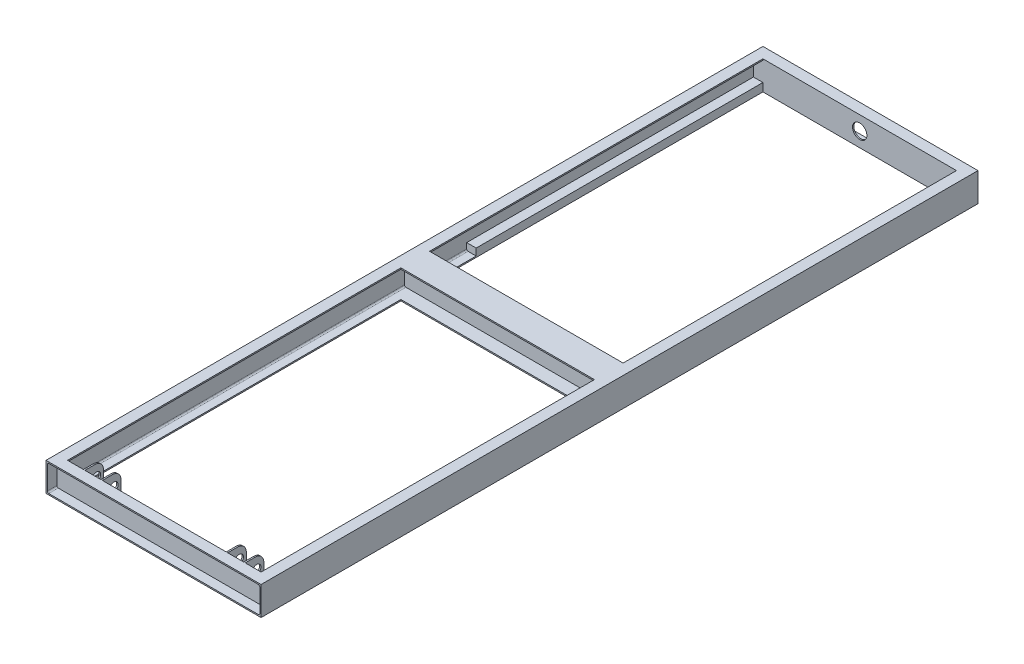
from build123d import *

# Parameters (mm, degrees)
EXTRUDE_1_DEPTH          = 5000
EXTRUDE_3_DEPTH          = 1500
EXTRUDE_START            = -5000
EXTRUDE_4_DEPTH          = 5000
SKETCH_5_W               = 10
SKETCH_5_H               = 130
EXTRUDE_5_DEPTH          = 200
CUT_EXTRUDE_1_DEPTH      = 1006
CUT_EXTRUDE_1_DEPTH_BACK = 147
SKETCH_6_R               = 30
FILLET_1_R               = 60
SKETCH_7_W               = 70
SKETCH_7_H               = 2000
EXTRUDE_6_DEPTH          = 48
EXTRUDE_7_REACH          = 5224.593
SKETCH_9_R               = 50
CUT_EXTRUDE_2_DEPTH      = 219
SCALE_3_SCALE            = 0.345


with BuildPart() as part:
    # 草图1 → 凸台-拉伸1 (new body)
    with BuildSketch(Plane.XY):
        with BuildLine():
            Line((0, 40.367089679), (0, -159.632910321))
            Line((0, -159.632910321), (75, -159.632910321))
            Line((75, -159.632910321), (75, -150.632910321))
            Line((75, -150.632910321), (19, -150.632910321))
            ThreePointArc((19, -150.632910321), (11.928932188, -147.703978133), (9, -140.632910321))
            Line((9, -140.632910321), (9, 21.367089679))
            ThreePointArc((9, 21.367089679), (11.928932188, 28.43815749), (19, 31.367089679))
            Line((19, 31.367089679), (75, 31.367089679))
            Line((75, 31.367089679), (75, 40.367089679))
            Line((75, 40.367089679), (0, 40.367089679))
        make_face()
    extrude(amount=EXTRUDE_1_DEPTH)

    # 草图2 → 凸台-拉伸3 (add)
    with BuildSketch(Plane.ZY):
        Polygon((5000, 40.367089679), (4925, 40.367089679), (4925, -159.632910321), (5000, -159.632910321), (5000, -150.632910321), (4934, -150.632910321), (4934, 31.367089679), (5000, 31.367089679), align=None)
        Polygon((0, -150.632910321), (0, -159.632910321), (75, -159.632910321), (75, 40.367089679), (0, 40.367089679), (0, 31.367089679), (66, 31.367089679), (66, -150.632910321), align=None)
    extrude(amount=-EXTRUDE_3_DEPTH)

    # 草图3 → 凸台-拉伸4 (add)
    with BuildSketch(Plane(origin=(0, 0, 0), x_dir=(-1, 0, 0), z_dir=(0, 0, -1)).offset(EXTRUDE_START)):
        with BuildLine():
            Line((-1500, 40.367089679), (-1425, 40.367089679))
            Line((-1425, 40.367089679), (-1425, 31.367089679))
            Line((-1425, 31.367089679), (-1481, 31.367089679))
            ThreePointArc((-1481, 31.367089679), (-1488.071067812, 28.43815749), (-1491, 21.367089679))
            Line((-1491, 21.367089679), (-1491, -140.632910321))
            ThreePointArc((-1491, -140.632910321), (-1488.071067812, -147.703978133), (-1481, -150.632910321))
            Line((-1481, -150.632910321), (-1425, -150.632910321))
            Line((-1425, -150.632910321), (-1425, -159.632910321))
            Line((-1425, -159.632910321), (-1500, -159.632910321))
            Line((-1500, -159.632910321), (-1500, 40.367089679))
        make_face()
    extrude(amount=EXTRUDE_4_DEPTH)

    # 草图5 → 凸台-拉伸5 (add)
    with BuildSketch(Plane(origin=(0, 40.367089679, 0), x_dir=(1, 0, 0), z_dir=(0, 1, 0))):
        with Locations((191, -4860)):
            Rectangle(SKETCH_5_W, SKETCH_5_H)
        with Locations((313, -4860)):
            Rectangle(SKETCH_5_W, SKETCH_5_H)
        with Locations((1309, -4860)):
            Rectangle(SKETCH_5_W, SKETCH_5_H)
        with Locations((1187, -4860)):
            Rectangle(SKETCH_5_W, SKETCH_5_H)
    extrude(amount=-EXTRUDE_5_DEPTH)

    # 草图6 → 切除-拉伸1 (cut, two sides: drawn at the far end of the back side and taken through both)
    with BuildSketch(Plane(origin=(318, 0, 0), x_dir=(0, 0, -1), z_dir=(1, 0, 0)).offset(-CUT_EXTRUDE_1_DEPTH_BACK)):
        with Locations((-4845, -39.632910321)):
            Circle(SKETCH_6_R)
    extrude(amount=CUT_EXTRUDE_1_DEPTH + CUT_EXTRUDE_1_DEPTH_BACK, mode=Mode.SUBTRACT)

    # 圆角1
    fillet_1_edges = [part.edges().sort_by_distance(p)[0] for p in [
        (191, -159.632910321, 4795),
        (191, 40.367089679, 4795),
        (313, -159.632910321, 4795),
        (313, 40.367089679, 4795),
        (1187, -159.632910321, 4795),
        (1187, 40.367089679, 4795),
        (1309, -159.632910321, 4795),
        (1309, 40.367089679, 4795),
    ]]
    fillet(fillet_1_edges, radius=FILLET_1_R)

    # 草图7 → 凸台-拉伸6 (add)
    with BuildSketch(Plane(origin=(0, -150.632910321, 0), x_dir=(1, 0, 0), z_dir=(0, 1, 0))):
        with Locations((40, -1075)):
            Rectangle(SKETCH_7_W, SKETCH_7_H)
        with Locations((1460, -1075)):
            Rectangle(SKETCH_7_W, SKETCH_7_H)
    extrude(amount=EXTRUDE_6_DEPTH)

    # 凸台-拉伸7: up to this face of the body (flat: up to its plane)
    extrude_7_end = Plane(part.part.faces().sort_by_distance((1491, -52.993485212, 2652.59969001))[0])
    # 草图8 → 凸台-拉伸7 (add, up to the picked face)
    with BuildSketch(Plane.ZY, mode=Mode.PRIVATE) as extrude_7_sk1:
        Polygon((2400, 40.367089679), (2600, 40.367089679), (2600, 31.367089679), (2509, 31.367089679), (2509, -150.632910321), (2600, -150.632910321), (2600, -159.632910321), (2400, -159.632910321), (2400, -150.632910321), (2491, -150.632910321), (2491, 31.367089679), (2400, 31.367089679), align=None)
    extrude_7_tool1 = split(extrude(extrude_7_sk1.sketch, amount=-EXTRUDE_7_REACH, mode=Mode.PRIVATE), bisect_by=extrude_7_end, keep=Keep.BOTH, mode=Mode.PRIVATE)
    add(extrude_7_tool1.solids().sort_by(Axis((0, -59.63291, 2500), (1, 0, 0)))[0])

    # 草图9 → 切除-拉伸2 (cut)
    with BuildSketch(Plane(origin=(0, 0, 66), x_dir=(-1, 0, 0), z_dir=(0, 0, -1))):
        with Locations((-750, -59.632910321)):
            Circle(SKETCH_9_R)
    extrude(amount=-CUT_EXTRUDE_2_DEPTH, mode=Mode.SUBTRACT)


with BuildPart() as part_1:
    # 缩放比例3: scaled about (0, 0, 0)
    add(part.part.scale(SCALE_3_SCALE))


solid = part_1.part
